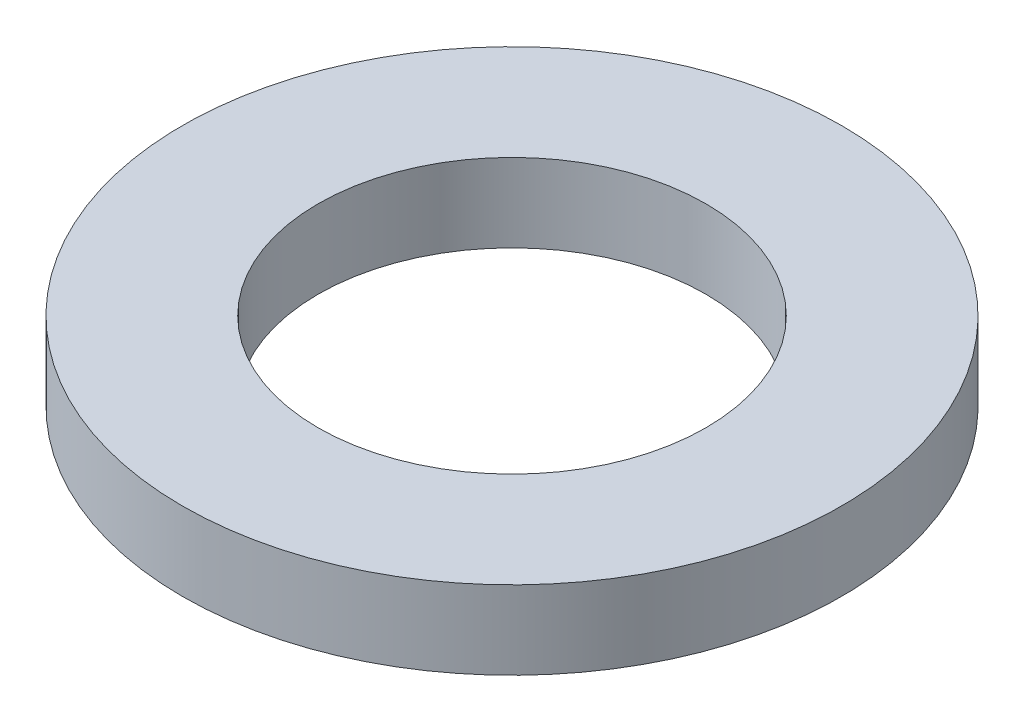
from build123d import *

# Parameters (mm, degrees)
SKETCH1_R           = 11.1125
BOSS_EXTRUDE1_DEPTH = 2.6416
SKETCH5_R           = 6.5405
CUT_EXTRUDE1_DEPTH  = 16.935914252


with BuildPart() as part:
    # Sketch1 → Boss-Extrude1 (new body)
    with BuildSketch(Plane(origin=(0, 0, 0), x_dir=(1, 0, 0), z_dir=(0, 1, 0))):
        with Locations(Location((0, 0, 0), (0, 0, 270))):
            Circle(SKETCH1_R)
    extrude(amount=BOSS_EXTRUDE1_DEPTH)

    # Sketch5 → Cut-Extrude1 (cut, through all)
    with BuildSketch(Plane(origin=(0, 2.6416, 0), x_dir=(-1, 0, 0), z_dir=(0, 1, 0))):
        with Locations(Location((0, 0, 0), (0, 0, 90))):
            Circle(SKETCH5_R)
    extrude(amount=-CUT_EXTRUDE1_DEPTH, mode=Mode.SUBTRACT)


solid = part.part
